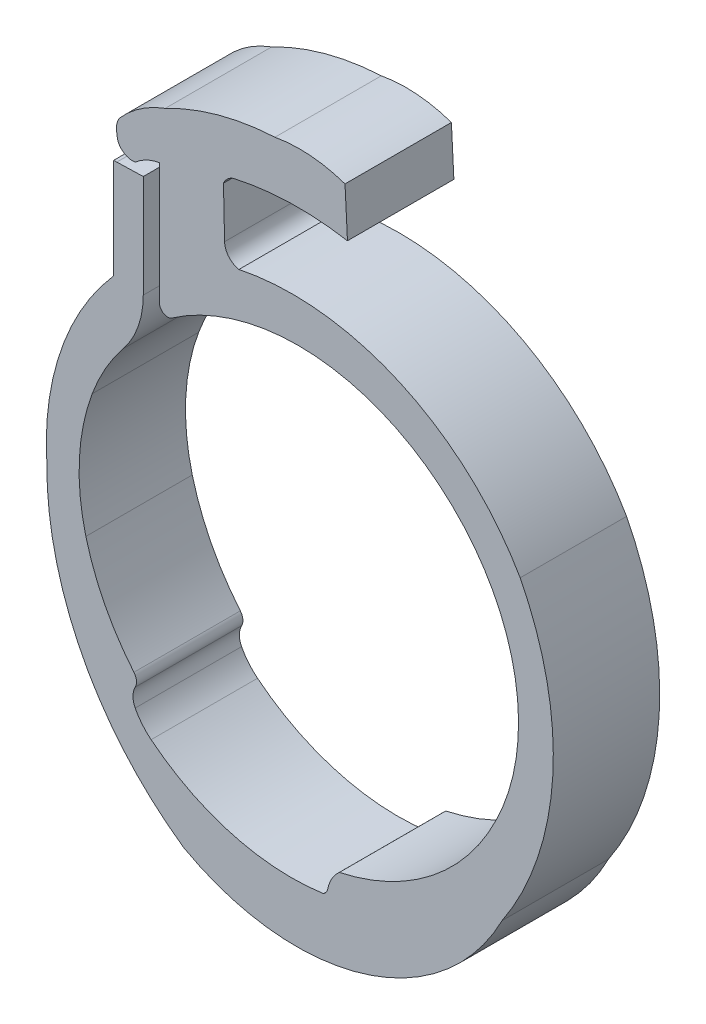
from build123d import *

# Parameters (mm, degrees)
BOSS_EXTRUDE1_DEPTH = 11


with BuildPart() as part:
    # Sketch1 → Boss-Extrude1 (new body)
    with BuildSketch(Plane.XY):
        with BuildLine():
            Line((-18.853830773, 25.160435071), (-16.119000888, 25.233110696))
            Line((-16.119000888, 25.233110696), (-16.119000888, 14.613334924))
            ThreePointArc((-16.119000888, 14.613334924), (-16.64958264, 11.530072447), (-18.180286861, 8.801525384))
            ThreePointArc((-18.180286861, 8.801525384), (-20.022572688, 6.105775505), (-21.399060798, 3.144970722))
            ThreePointArc((-21.399060798, 3.144970722), (-22.726569744, -3.354769567), (-22.053552104, -9.954462823))
            ThreePointArc((-22.053552104, -9.954462823), (-20.106400366, -15.071180428), (-17.085436321, -19.636919707))
            ThreePointArc((-17.085436321, -19.636919707), (-16.826323912, -20.249507523), (-16.951603049, -20.902736587))
            ThreePointArc((-16.951603049, -20.902736587), (-17.18386468, -21.838882371), (-16.955503917, -22.775987357))
            ThreePointArc((-16.955503917, -22.775987357), (-16.236029845, -23.865360174), (-15.307939029, -24.783523292))
            ThreePointArc((-15.307939029, -24.783523292), (-6.902922169, -29.070783982), (2.514195466, -29.656282157))
            ThreePointArc((2.514195466, -29.656282157), (2.798104907, -29.369092957), (2.954895281, -28.996938438))
            ThreePointArc((2.954895281, -28.996938438), (3.387996909, -27.87172525), (4.151482129, -26.938573569))
            ThreePointArc((4.151482129, -26.938573569), (13.70577614, -22.445002036), (20.325671696, -14.219814986))
            ThreePointArc((20.325671696, -14.219814986), (22.482847249, -1.351664436), (17.013236546, 10.494265824))
            ThreePointArc((17.013236546, 10.494265824), (2.522103549, 17.974028049), (-13.285319782, 13.96589306))
            ThreePointArc((-13.285319782, 13.96589306), (-14.010252719, 14.025446056), (-14.438576198, 14.613334924))
            Line((-14.438576198, 14.613334924), (-14.463639713, 27.310804635))
            ThreePointArc((-14.463639713, 27.310804635), (-15.772674476, 26.882496645), (-16.921609527, 26.122912554))
            ThreePointArc((-16.921609527, 26.122912554), (-18.247717994, 26.438122976), (-18.831203914, 27.669977456))
            ThreePointArc((-18.831203914, 27.669977456), (-18.868217492, 28.483440244), (-18.573500133, 29.242540627))
            ThreePointArc((-18.573500133, 29.242540627), (-16.413121418, 31.153842986), (-13.848257568, 32.473610515))
            ThreePointArc((-13.848257568, 32.473610515), (-8.344696861, 34.627822793), (-2.50820992, 35.558000832))
            ThreePointArc((-2.50820992, 35.558000832), (1.150912858, 35.75032292), (4.737729096, 35.001379281))
            Line((4.737729096, 35.001379281), (4.992549443, 30.035082131))
            ThreePointArc((4.992549443, 30.035082131), (-0.915054965, 30.467339098), (-6.792394138, 29.7301009))
            ThreePointArc((-6.792394138, 29.7301009), (-7.409462923, 29.370020494), (-7.826896167, 28.790209084))
            Line((-7.826896167, 28.790209084), (-7.712079502, 23.601110726))
            ThreePointArc((-7.712079502, 23.601110726), (-7.280949637, 22.466131343), (-6.230949855, 21.856581002))
            ThreePointArc((-6.230949855, 21.856581002), (10.429887602, 20.043351617), (22.848599934, 8.789601594))
            ThreePointArc((22.848599934, 8.789601594), (26.218834648, -7.288142965), (20.968539738, -22.853706092))
            ThreePointArc((20.968539738, -22.853706092), (6.607574044, -34.777230529), (-11.948618389, -32.758445472))
            ThreePointArc((-11.948618389, -32.758445472), (-22.400695848, -20.847022299), (-26.08676765, -5.434663624))
            ThreePointArc((-26.08676765, -5.434663624), (-24.658208176, 5.345172428), (-19.217331386, 14.760187417))
            Line((-19.217331386, 14.760187417), (-19.177343822, 25.15499714))
            Line((-19.177343822, 25.15499714), (-18.853830773, 25.160435071))
        make_face()
    extrude(amount=BOSS_EXTRUDE1_DEPTH)


solid = part.part
